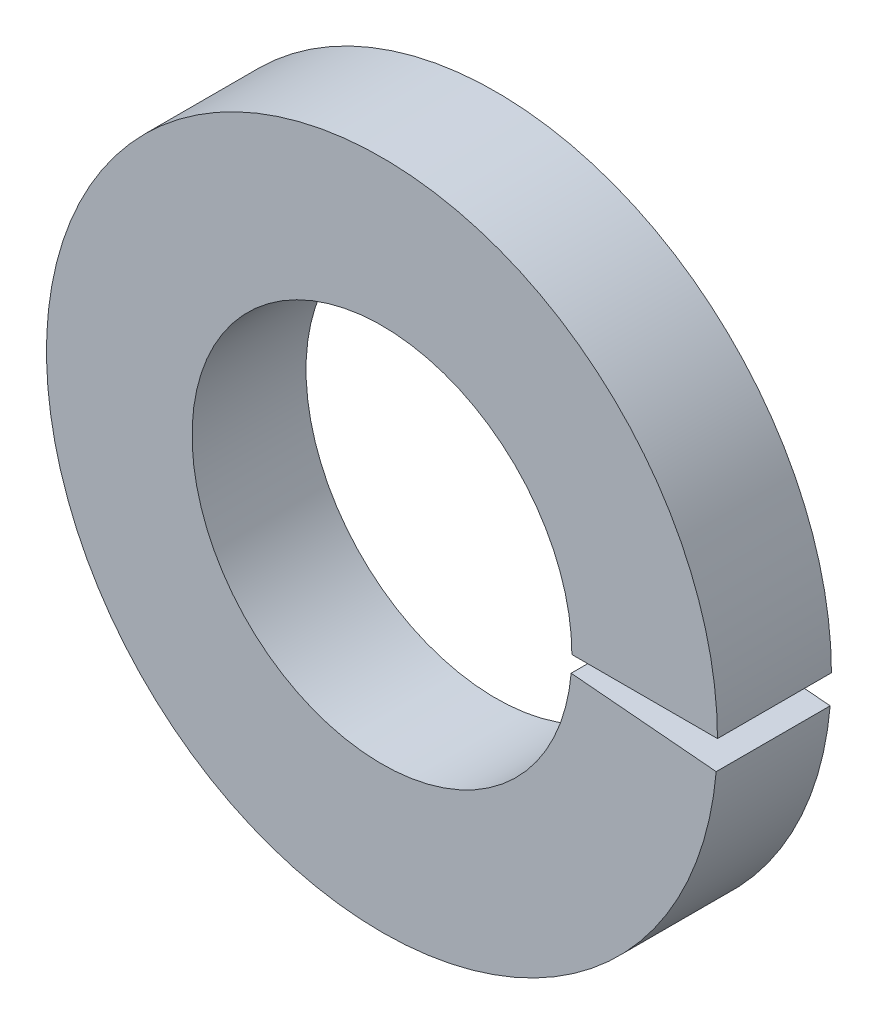
from build123d import *

# Parameters (mm, degrees)
EXTRUDE_1_DEPTH = 0.9


with BuildPart() as part:
    # 草图1 → 凸台-拉伸1 (new body)
    with BuildSketch(Plane.XY):
        with BuildLine():
            Line((1.5, 0), (2.65, 0))
            ThreePointArc((2.65, 0), (-2.647477787, 0.115591377), (2.63991595, -0.230962718))
            Line((2.63991595, -0.230962718), (1.494292047, -0.130733614))
            ThreePointArc((1.494292047, -0.130733614), (-1.498572332, 0.065429081), (1.5, 0))
        make_face()
    extrude(amount=EXTRUDE_1_DEPTH)


solid = part.part
